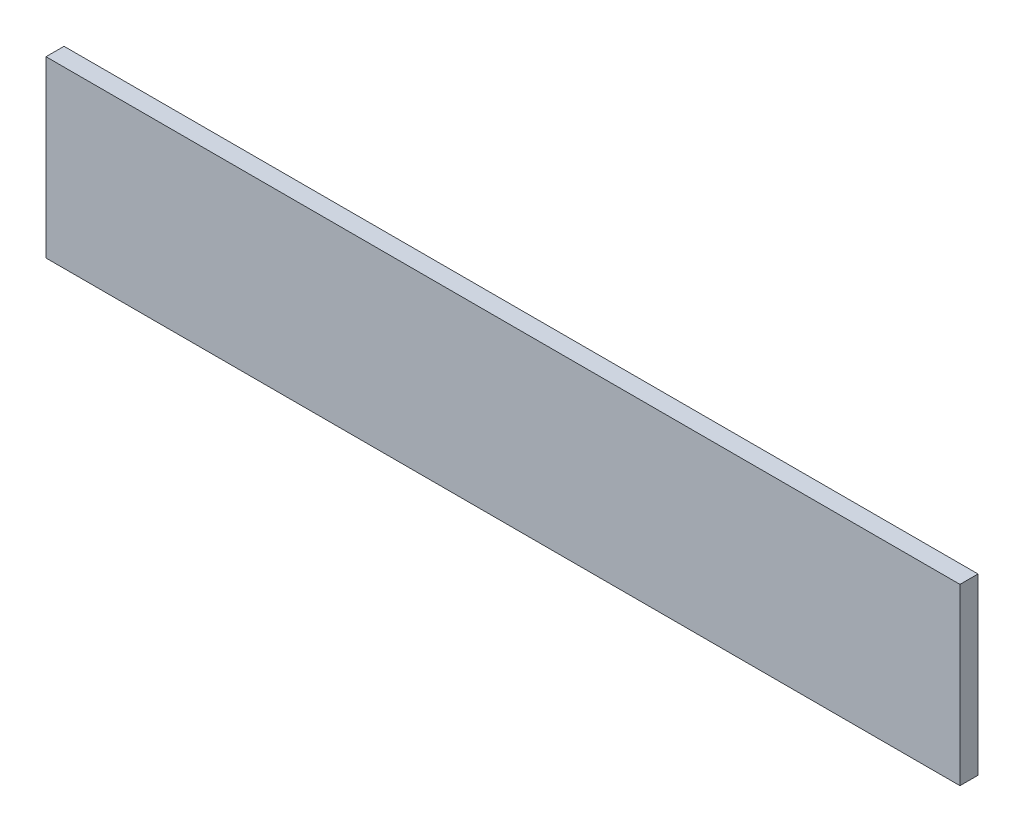
from build123d import *

# Parameters (mm, degrees)
SKETCH1_W           = 965.2
SKETCH1_H           = 184.15
BOSS_EXTRUDE1_DEPTH = 19.05


with BuildPart() as part:
    # Sketch1 → Boss-Extrude1 (new body)
    with BuildSketch(Plane.XY):
        with Locations((482.6, 92.075)):
            Rectangle(SKETCH1_W, SKETCH1_H)
    extrude(amount=BOSS_EXTRUDE1_DEPTH)


solid = part.part
